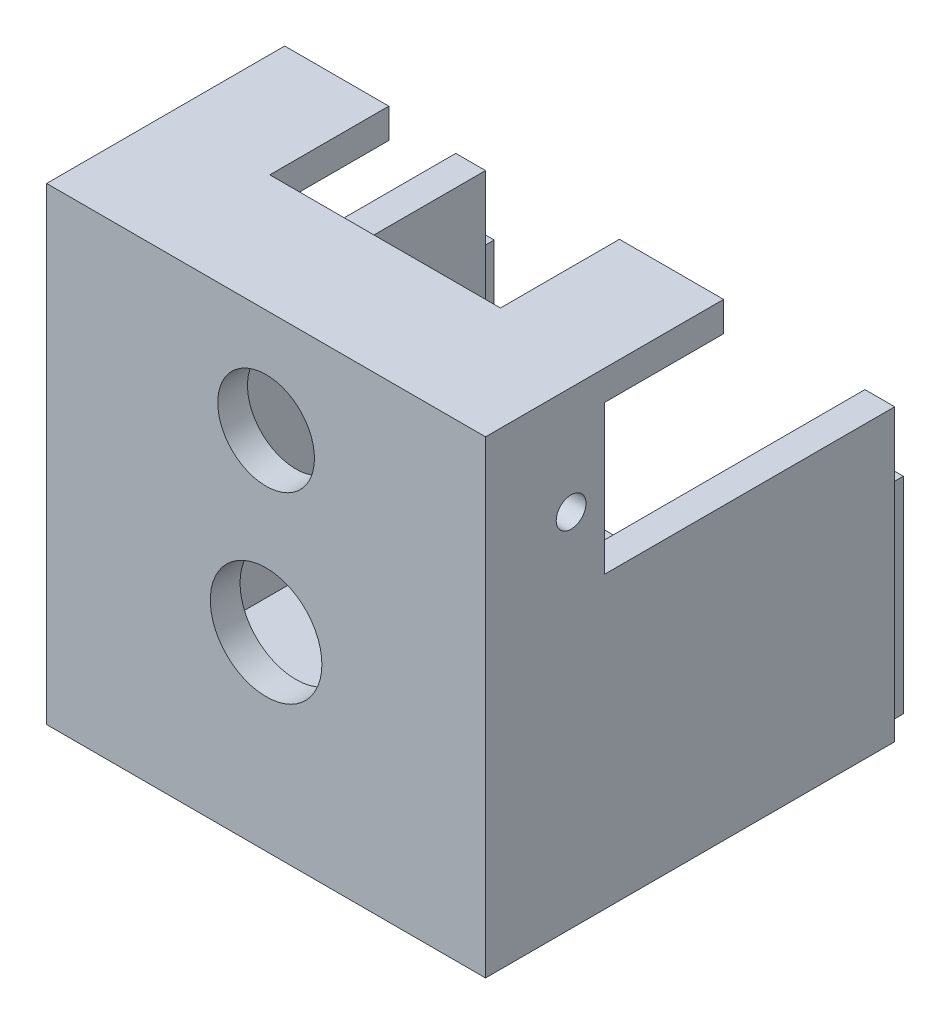
from build123d import *

# Parameters (mm, degrees)
SKETCH1_W           = 59
SKETCH1_H           = 20
SKETCH1_R           = 6.5
BOSS_EXTRUDE1_DEPTH = 4
SKETCH2_W           = 59
SKETCH2_H           = 16
BOSS_EXTRUDE2_DEPTH = 4
SKETCH3_W           = 14
SKETCH3_H           = 4
BOSS_EXTRUDE3_DEPTH = 16
SKETCH4_W           = 4
SKETCH4_H           = 20
BOSS_EXTRUDE4_DEPTH = 12
SKETCH5_R           = 2
CUT_EXTRUDE1_DEPTH  = 80
BOSS_EXTRUDE7_DEPTH = 35
SKETCH9_W           = 59
SKETCH9_H           = 55
BOSS_EXTRUDE8_DEPTH = 4
SKETCH10_W          = 55
SKETCH10_H          = 1.333333334
SKETCH10_W_2        = 1.333333334
SKETCH10_H_2        = 26.333333333
BOSS_EXTRUDE9_DEPTH = 2.5
SKETCH11_R          = 7.5
CUT_EXTRUDE2_DEPTH  = 5


with BuildPart() as part:
    # Sketch1 → Boss-Extrude1 (new body)
    with BuildSketch(Plane.XY):
        Rectangle(SKETCH1_W, SKETCH1_H)
        Circle(SKETCH1_R, mode=Mode.SUBTRACT)
    extrude(amount=BOSS_EXTRUDE1_DEPTH)

    # Sketch2 → Boss-Extrude2 (add)
    with BuildSketch(Plane(origin=(0, 10, 0), x_dir=(1, 0, 0), z_dir=(0, 1, 0))):
        with Locations((0, 4)):
            Rectangle(SKETCH2_W, SKETCH2_H)
    extrude(amount=BOSS_EXTRUDE2_DEPTH)

    # Sketch3 → Boss-Extrude3 (add)
    with BuildSketch(Plane(origin=(0, 0, -12), x_dir=(-1, 0, 0), z_dir=(0, 0, -1))):
        with Locations((-22.5, 12)):
            Rectangle(SKETCH3_W, SKETCH3_H)
        with Locations((22.5, 12)):
            Rectangle(SKETCH3_W, SKETCH3_H)
    extrude(amount=BOSS_EXTRUDE3_DEPTH)

    # Sketch4 → Boss-Extrude4 (add)
    with BuildSketch(Plane(origin=(0, 0, 0), x_dir=(-1, 0, 0), z_dir=(0, 0, -1))):
        with Locations((27.5, 0)):
            Rectangle(SKETCH4_W, SKETCH4_H)
        with Locations((-27.5, 0)):
            Rectangle(SKETCH4_W, SKETCH4_H)
    extrude(amount=BOSS_EXTRUDE4_DEPTH)

    # Sketch5 → Cut-Extrude1 (cut)
    with BuildSketch(Plane.ZY.offset(29.5)):
        with Locations((-7.5, -0.5)):
            Circle(SKETCH5_R)
    extrude(amount=-CUT_EXTRUDE1_DEPTH, mode=Mode.SUBTRACT)

    # Sketch8 → Boss-Extrude7 (add)
    with BuildSketch(Plane.XZ.offset(10)):
        Polygon((25.5, -51), (29.5, -51), (29.5, 4), (-29.5, 4), (-29.5, -51), (-25.5, -51), (-25.5, 0), (25.5, 0), align=None)
    extrude(amount=BOSS_EXTRUDE7_DEPTH)

    # Sketch9 → Boss-Extrude8 (add)
    with BuildSketch(Plane.XZ.offset(45)):
        with Locations((0, -23.5)):
            Rectangle(SKETCH9_W, SKETCH9_H)
    extrude(amount=BOSS_EXTRUDE8_DEPTH)

    # Sketch10 → Boss-Extrude9 (add)
    with BuildSketch(Plane(origin=(0, 0, -51), x_dir=(-1, 0, 0), z_dir=(0, 0, -1))):
        Polygon((-28.166666667, -47.666666667), (-26.833333333, -47.666666667), (-26.833333333, -46.333333333), (-26.833333333, -20), (-28.166666667, -20), align=None)
        with Locations((0.666666667, -47)):
            Rectangle(SKETCH10_W, SKETCH10_H)
        with Locations((27.5, -33.166666667)):
            Rectangle(SKETCH10_W_2, SKETCH10_H_2)
    extrude(amount=BOSS_EXTRUDE9_DEPTH)

    # Sketch11 → Cut-Extrude2 (cut)
    with BuildSketch(Plane.XY.offset(4)):
        with Locations((0, -23.5)):
            Circle(SKETCH11_R)
    extrude(amount=-CUT_EXTRUDE2_DEPTH, mode=Mode.SUBTRACT)


solid = part.part
